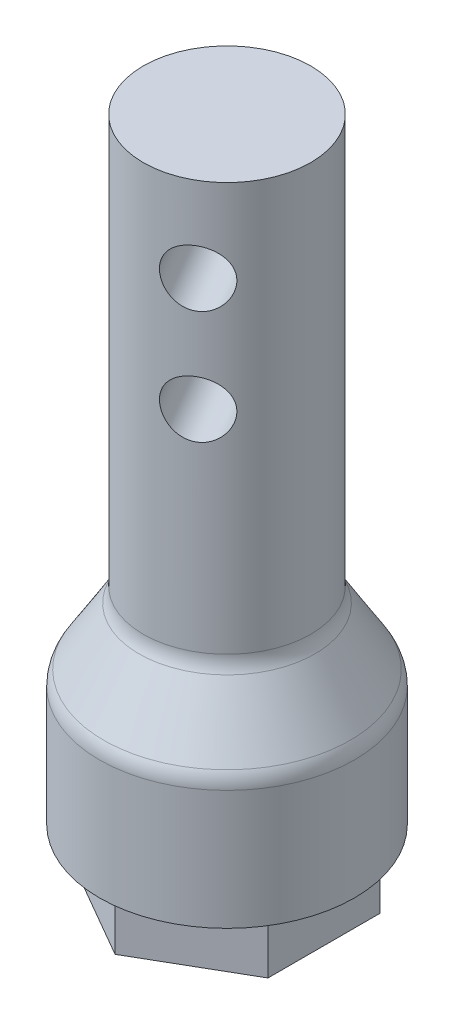
from build123d import *

# Parameters (mm, degrees)
TAGLIO_ESTRUSIONE1_START      = -2
SCHIZZO2_R                    = 4.5
TAGLIO_ESTRUSIONE1_DEPTH      = 2
FORO_FILETTATO_M3X0_5_1_D     = 2.5
FORO_FILETTATO_M3X0_5_1_DEPTH = 9
FORO_FILETTATO_M3X0_5_1_TIP   = 0.751075774
SCHIZZO5_R                    = 1
TAGLIO_ESTRUSIONE2_DEPTH      = 34.021984674


with BuildPart() as part:
    # Schizzo1 → Rivoluzione1 (revolve)
    with BuildSketch(Plane.XY, mode=Mode.PRIVATE) as rivoluzione1_sk:
        with BuildLine():
            Line((0, 0), (4.5, 0))
            Line((4.5, 0), (4.5, 6.215934246))
            ThreePointArc((4.5, 6.215934246), (4.461941718, 6.489188945), (4.350663738, 6.741644436))
            Line((4.350663738, 6.741644436), (3.104336262, 8.758355564))
            ThreePointArc((3.104336262, 8.758355564), (2.993058282, 9.010811055), (2.955, 9.284065754))
            Line((2.955, 9.284065754), (2.955, 31.7))
            Line((2.955, 31.7), (0, 31.7))
            Line((0, 31.7), (0, 0))
        make_face()
    revolve(rivoluzione1_sk.sketch.rotate(Axis((0, 31.7, 0), (0, -1, 0)), 180), axis=Axis((0, 31.7, 0), (0, -1, 0)))

    # Schizzo2 → Taglio-Estrusione1 (cut)
    with BuildSketch(Plane.XZ.offset(TAGLIO_ESTRUSIONE1_START)):
        with Locations(Location((0, 0, 0), (0, 0, 180))):
            Circle(SCHIZZO2_R)
        Polygon((0, 3.95), (-3.420800345, 1.975), (-3.420800345, -1.975), (0, -3.95), (3.420800345, -1.975), (3.420800345, 1.975), align=None, mode=Mode.SUBTRACT)
    extrude(amount=TAGLIO_ESTRUSIONE1_DEPTH, mode=Mode.SUBTRACT)

    # Foro filettato M3x0.5-1
    with Locations(Plane(origin=(0, 0, 0), x_dir=(-1, 0, 0), z_dir=(0, -1, 0))):
        with Locations((0, 0)):
            Hole(FORO_FILETTATO_M3X0_5_1_D / 2, depth=FORO_FILETTATO_M3X0_5_1_DEPTH)
            with Locations((0, 0, -(FORO_FILETTATO_M3X0_5_1_DEPTH + FORO_FILETTATO_M3X0_5_1_TIP / 2))):  # 118° drill point
                Cone(0, FORO_FILETTATO_M3X0_5_1_D / 2, FORO_FILETTATO_M3X0_5_1_TIP, mode=Mode.SUBTRACT)

    # Schizzo5 → Taglio-Estrusione2 (cut, through all)
    with BuildSketch(Plane(origin=(-1.4775, 0, -2.559105068), x_dir=(-0.8660254037844385, 0, 0.5000000000000004), z_dir=(-0.5000000000000003, 0, -0.8660254037844384))):
        with Locations((0, 16.7)):
            Circle(SCHIZZO5_R)
        with Locations((0, 20.7)):
            Circle(SCHIZZO5_R)
        with Locations((0, 24.7)):
            Circle(SCHIZZO5_R)
        with Locations((0, 28.7)):
            Circle(SCHIZZO5_R)
    extrude(amount=-TAGLIO_ESTRUSIONE2_DEPTH, mode=Mode.SUBTRACT)

    # TaglioSuperficie1
    split(bisect_by=Plane(origin=(0, 23.7, 0), x_dir=(1, 0, 0), z_dir=(0, 1, 0)), keep=Keep.BOTTOM)


solid = part.part
